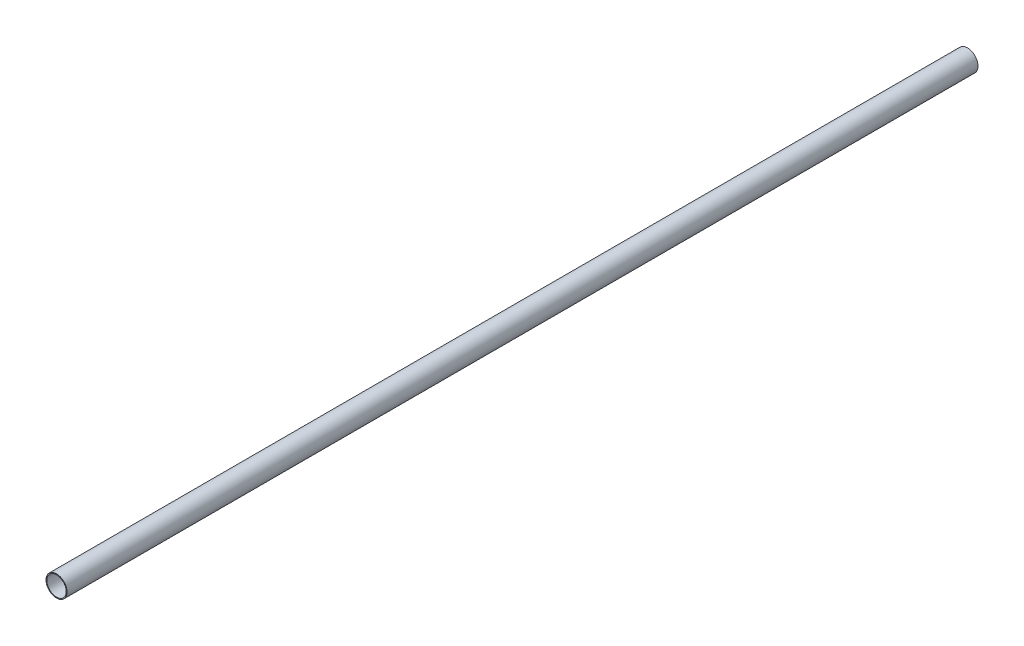
from build123d import *

# Parameters (mm, degrees)
SKETCH1_R           = 12.5603
SKETCH1_R_2         = 11.5443
BOSS_EXTRUDE1_DEPTH = 1085.85


with BuildPart() as part:
    # Sketch1 → Boss-Extrude1 (new body)
    with BuildSketch(Plane.XY):
        Circle(SKETCH1_R)
        Circle(SKETCH1_R_2, mode=Mode.SUBTRACT)
    extrude(amount=BOSS_EXTRUDE1_DEPTH)


solid = part.part
